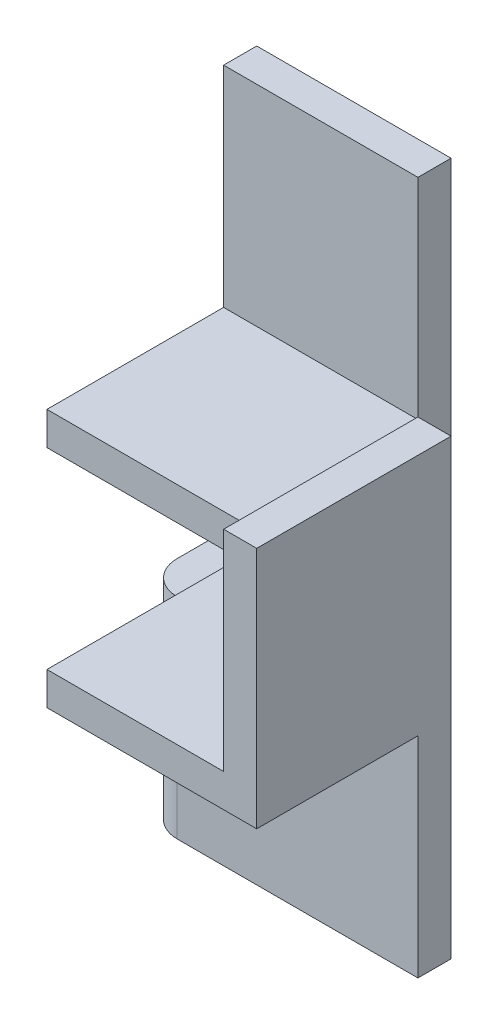
from build123d import *

# Parameters (mm, degrees)
SKETCH1_W             = 24.13
SKETCH1_H             = 22.352
BOSS_EXTRUDE1_DEPTH   = 3.81
SKETCH1_W_2           = 22.352
SKETCH1_H_2           = 24.13
BOSS_EXTRUDE1_2_DEPTH = 3.81
SKETCH2_W             = 22.352
SKETCH2_H             = 3.81
SKETCH2_W_2           = 3.81
SKETCH2_H_2           = 22.352
BOSS_EXTRUDE2_DEPTH   = 24.13
BOSS_EXTRUDE3_DEPTH   = 24.13
FILLET1_R             = 3.81


with BuildPart() as part:
    # Sketch1 → Boss-Extrude1 (new body)
    with BuildSketch(Plane(origin=(0, 0, 0), x_dir=(1, 0, 0), z_dir=(0, 1, 0))):
        with Locations((37.973, -38.862)):
            Rectangle(SKETCH1_W, SKETCH1_H)
    extrude(amount=BOSS_EXTRUDE1_DEPTH)



with BuildPart() as body_2:
    # Sketch1 → Boss-Extrude1 2 (new body)
    with BuildSketch(Plane(origin=(0, 0, 0), x_dir=(1, 0, 0), z_dir=(0, 1, 0))):
        with Locations((11.176, -12.065)):
            Rectangle(SKETCH1_W_2, SKETCH1_H_2)
    extrude(amount=BOSS_EXTRUDE1_2_DEPTH)


with BuildPart() as part_1:
    add(part.part)

    add(body_2.part)  # Boss-Extrude2 merges body 2
    # Sketch2 → Boss-Extrude2 (add)
    with BuildSketch(Plane(origin=(0, 3.81, 0), x_dir=(1, 0, 0), z_dir=(0, 1, 0))):
        with Locations((11.176, -1.905)):
            Rectangle(SKETCH2_W, SKETCH2_H)
        with Locations((48.133, -38.862)):
            Rectangle(SKETCH2_W_2, SKETCH2_H_2)
    extrude(amount=BOSS_EXTRUDE2_DEPTH)

    # Sketch3 → Boss-Extrude3 (add)
    with BuildSketch(Plane.XZ):
        Polygon((22.352, 27.686), (50.038, 27.686), (50.038, 31.496), (18.542, 31.496), (18.542, 0), (22.352, 0), align=None)
    extrude(amount=BOSS_EXTRUDE3_DEPTH)

    # Fillet1
    fillet1_edges = [part_1.edges().sort_by_distance(p)[0] for p in [
        (18.542, -12.065, 31.496),
    ]]
    fillet(fillet1_edges, radius=FILLET1_R)


solid = part_1.part
